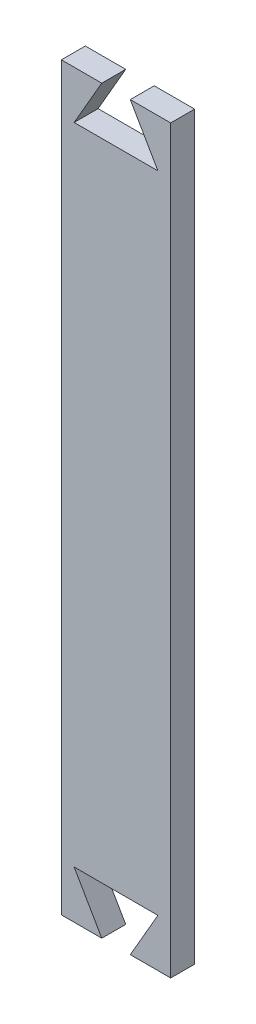
from build123d import *

# Parameters (mm, degrees)
BOSS_EXTRUDE1_DEPTH = 5.08


with BuildPart() as part:
    # Sketch1 → Boss-Extrude1 (new body)
    with BuildSketch(Plane.XY):
        Polygon((-3.024121265, 0), (-8.89, 10.16), (8.89, 10.16), (3.024121265, 0), (11.5976146, 0), (11.5976146, 157.1625), (3.024121265, 157.1625), (8.89, 147.0025), (-8.89, 147.0025), (-3.024121265, 157.1625), (-11.5976146, 157.1625), (-11.5976146, 0), align=None)
    extrude(amount=BOSS_EXTRUDE1_DEPTH)


solid = part.part
